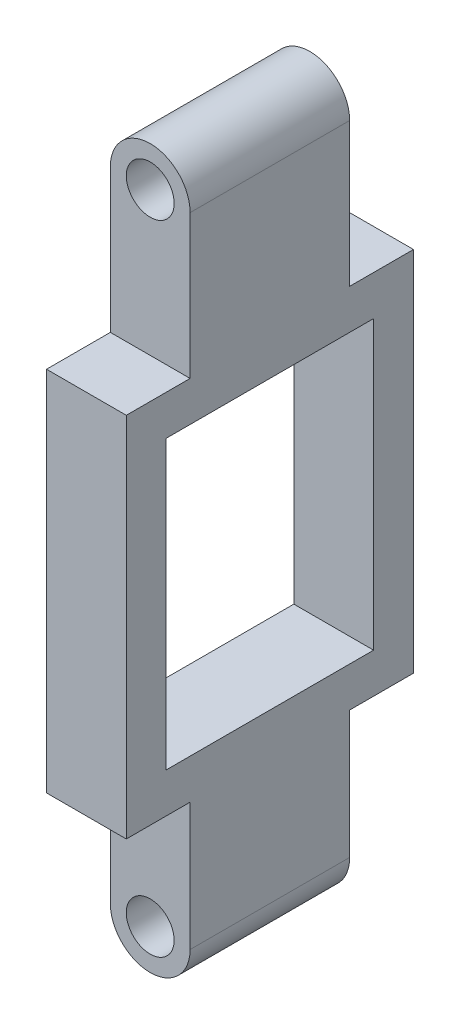
from build123d import *

# Parameters (mm, degrees)
SCHIZZO1_R                   = 15
ESTRUSIONE_ESTRUSIONE1_DEPTH = 50
SCHIZZO2_W                   = 50
SCHIZZO2_H                   = 230
ESTRUSIONE_ESTRUSIONE2_DEPTH = 40
SCHIZZO3_W                   = 130
SCHIZZO3_H                   = 180
TAGLIO_ESTRUSIONE1_DEPTH     = 423.621427401


with BuildPart() as part:
    # Schizzo1 → Estrusione-Estrusione1 (new, symmetric)
    with BuildSketch(Plane.XY):
        with BuildLine():
            Line((25, 384.888851883), (25, -15.111148117))
            ThreePointArc((25, -15.111148117), (0, -40.111148117), (-25, -15.111148117))
            Line((-25, -15.111148117), (-25, 384.888851883))
            ThreePointArc((-25, 384.888851883), (0, 409.888851883), (25, 384.888851883))
        make_face()
        with Locations((0, 384.888851883)):
            Circle(SCHIZZO1_R, mode=Mode.SUBTRACT)
        with Locations((0, -15.111148117)):
            Circle(SCHIZZO1_R, mode=Mode.SUBTRACT)
    extrude(amount=ESTRUSIONE_ESTRUSIONE1_DEPTH, both=True)

    # Schizzo2 → Estrusione-Estrusione2 (add)
    with BuildSketch(Plane.XY.offset(50)):
        with Locations((0, 179.888851883)):
            Rectangle(SCHIZZO2_W, SCHIZZO2_H)
    estrusione_estrusione2 = extrude(amount=ESTRUSIONE_ESTRUSIONE2_DEPTH)

    # Specchia1: Estrusione-Estrusione2 across plane
    add(estrusione_estrusione2.mirror(Plane.XY))

    # Schizzo3 → Taglio-Estrusione1 (cut, through all)
    with BuildSketch(Plane(origin=(25, 0, 0), x_dir=(0, 0, -1), z_dir=(1, 0, 0))):
        with Locations((0, 179.888851883)):
            Rectangle(SCHIZZO3_W, SCHIZZO3_H)
    extrude(amount=-TAGLIO_ESTRUSIONE1_DEPTH, mode=Mode.SUBTRACT)


solid = part.part
